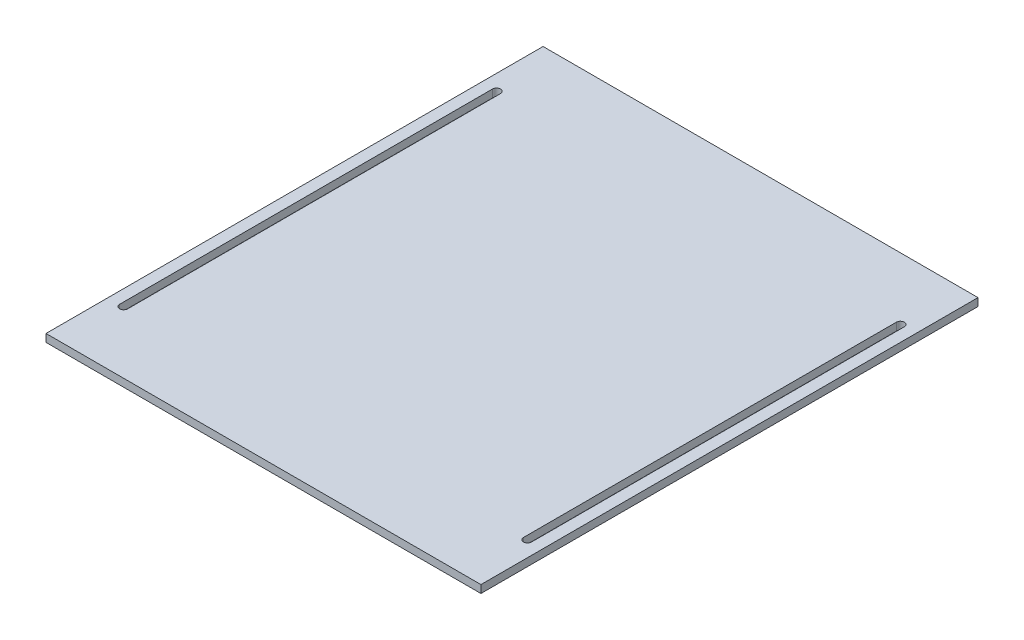
from build123d import *

# Parameters (mm, degrees)
SKETCH1_W           = 355.6
SKETCH1_H           = 406.4
BOSS_EXTRUDE1_DEPTH = 6.35
CUT_EXTRUDE1_DEPTH  = 6.35


with BuildPart() as part:
    # Sketch1 → Boss-Extrude1 (new body)
    with BuildSketch(Plane(origin=(0, 0, 0), x_dir=(1, 0, 0), z_dir=(0, 1, 0))):
        Rectangle(SKETCH1_W, SKETCH1_H)
    extrude(amount=BOSS_EXTRUDE1_DEPTH)

    # Sketch2 → Cut-Extrude1 (cut)
    with BuildSketch(Plane(origin=(0, 6.35, 0), x_dir=(1, 0, 0), z_dir=(0, 1, 0))):
        with BuildLine():
            Line((-161.8361, 152.4), (-161.8361, -152.4))
            ThreePointArc((-161.8361, -152.4), (-165.1, -155.6639), (-168.3639, -152.4))
            Line((-168.3639, -152.4), (-168.3639, 152.4))
            ThreePointArc((-168.3639, 152.4), (-165.1, 155.6639), (-161.8361, 152.4))
        make_face()
    cut_extrude1 = extrude(amount=-CUT_EXTRUDE1_DEPTH, mode=Mode.SUBTRACT)

    # Mirror1: Cut-Extrude1 across plane
    add(cut_extrude1.mirror(Plane(origin=(0, 0, 0), x_dir=(0, 0, 1), z_dir=(1, 0, 0))), mode=Mode.SUBTRACT)


solid = part.part
